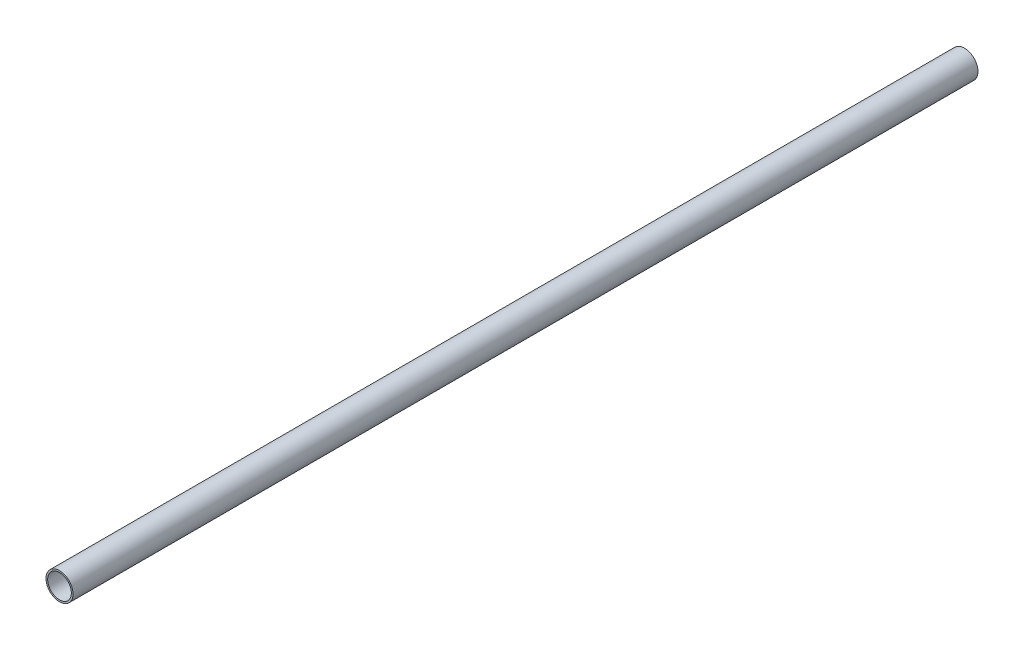
from build123d import *

# Parameters (mm, degrees)
SKETCH_1_R      = 8
SKETCH_1_R_2    = 7
EXTRUDE_1_DEPTH = 535


with BuildPart() as part:
    # Эскиз1 → Бобышка-Вытянуть1 (new body)
    with BuildSketch(Plane.XY):
        Circle(SKETCH_1_R)
        Circle(SKETCH_1_R_2, mode=Mode.SUBTRACT)
    extrude(amount=EXTRUDE_1_DEPTH)


solid = part.part
